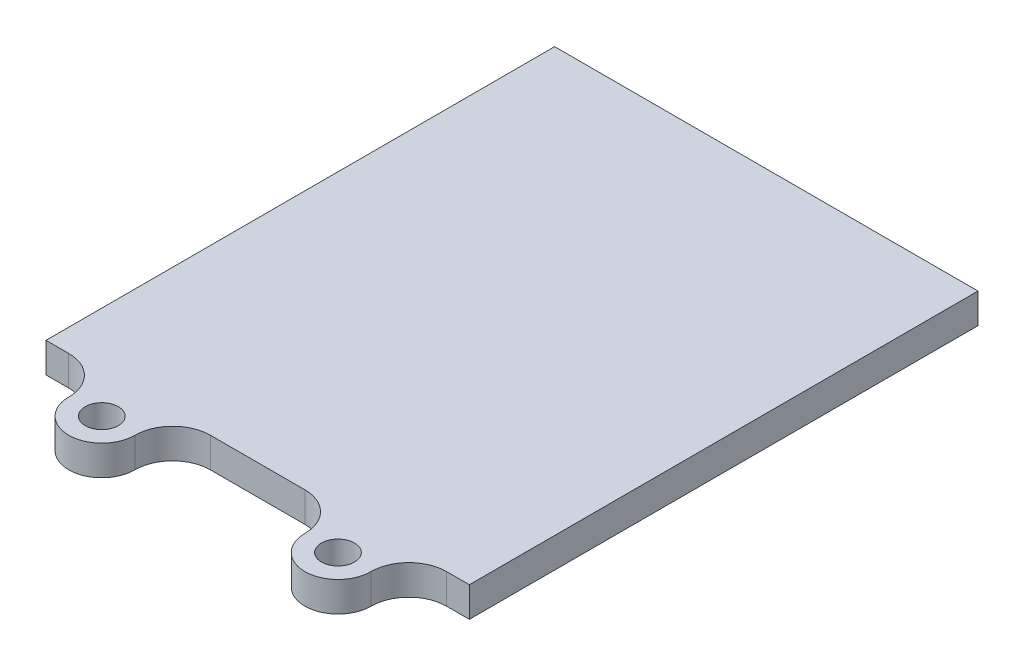
from build123d import *

# Parameters (mm, degrees)
SKETCH1_W           = 89.63
SKETCH1_H           = 107.7
BOSS_EXTRUDE1_DEPTH = 6.35
SKETCH2_R           = 3.5
BOSS_EXTRUDE2_DEPTH = 6.35


with BuildPart() as part:
    # Sketch1 → Boss-Extrude1 (new body)
    with BuildSketch(Plane(origin=(0, 0, 0), x_dir=(1, 0, 0), z_dir=(0, 1, 0))):
        Rectangle(SKETCH1_W, SKETCH1_H)
    extrude(amount=BOSS_EXTRUDE1_DEPTH)

    # Sketch2 → Boss-Extrude2 (add)
    # profile 1 of 2: a face of its own
    with BuildSketch(Plane(origin=(0, 0, 0), x_dir=(1, 0, 0), z_dir=(0, 1, 0))):
        with BuildLine():
            Line((-40, -53.85), (-10, -53.85))
            ThreePointArc((-10, -53.85), (-15.656854249, -56.193145751), (-18, -61.85))
            ThreePointArc((-18, -61.85), (-25, -68.85), (-32, -61.85))
            ThreePointArc((-32, -61.85), (-34.343145751, -56.193145751), (-40, -53.85))
        make_face()
        with Locations(Location((-25, -61.85, 0), (0, 0, 270))):
            Circle(SKETCH2_R, mode=Mode.SUBTRACT)
    # profile 2 of 2: a face of its own
    with BuildSketch(Plane(origin=(0, 0, 0), x_dir=(1, 0, 0), z_dir=(0, 1, 0))):
        with BuildLine():
            Line((40, -53.85), (10, -53.85))
            ThreePointArc((10, -53.85), (15.656854249, -56.193145751), (18, -61.85))
            ThreePointArc((18, -61.85), (25, -68.85), (32, -61.85))
            ThreePointArc((32, -61.85), (34.343145751, -56.193145751), (40, -53.85))
        make_face()
        with Locations(Location((25, -61.85, 0), (0, 0, 270))):
            Circle(SKETCH2_R, mode=Mode.SUBTRACT)
    extrude(amount=BOSS_EXTRUDE2_DEPTH)


solid = part.part
